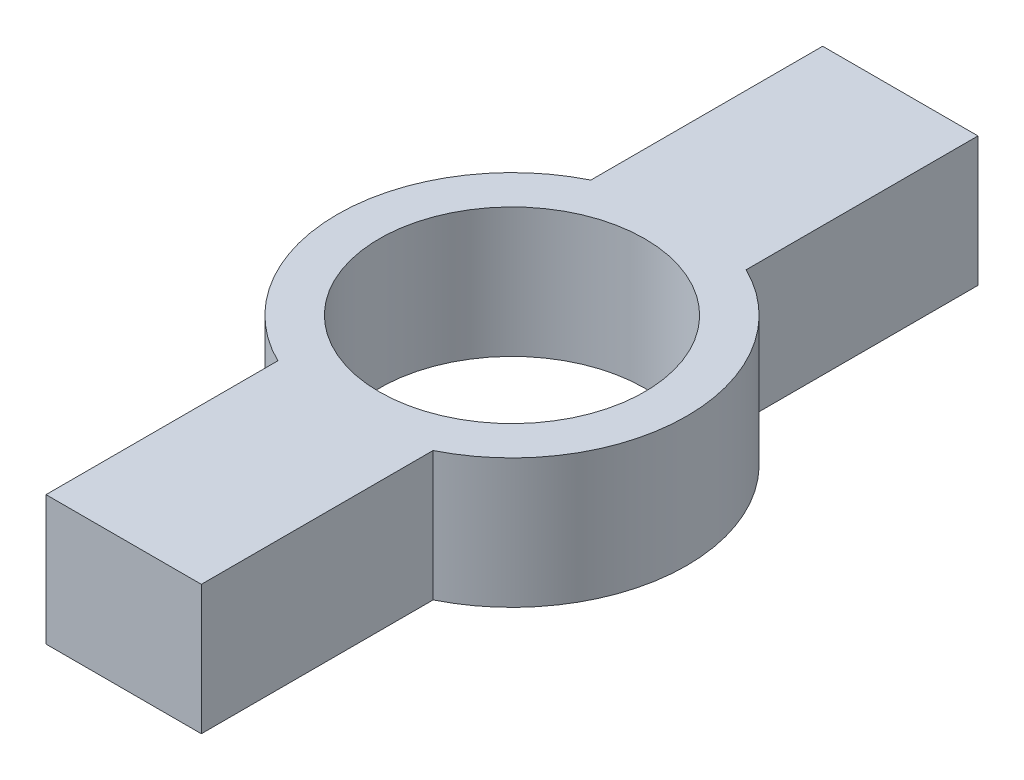
from build123d import *

# Parameters (mm, degrees)
SKETCH_1_R          = 13.5
EXTRUDE_1_DEPTH     = 10
SKETCH_2_W          = 12
SKETCH_2_H          = 60
EXTRUDE_2_DEPTH     = 10
SKETCH_3_R          = 10.25
CUT_EXTRUDE_1_DEPTH = 10


with BuildPart() as part:
    # 草图1 → 凸台-拉伸1 (new body)
    with BuildSketch(Plane(origin=(0, 0, 0), x_dir=(1, 0, 0), z_dir=(0, 1, 0))):
        with Locations(Location((0, 0, 0), (0, 0, 270))):
            Circle(SKETCH_1_R)
    extrude(amount=EXTRUDE_1_DEPTH)

    # 草图2 → 凸台-拉伸2 (add)
    with BuildSketch(Plane(origin=(0, 10, 0), x_dir=(1, 0, 0), z_dir=(0, 1, 0))):
        Rectangle(SKETCH_2_W, SKETCH_2_H)
    extrude(amount=-EXTRUDE_2_DEPTH)

    # 草图3 → 切除-拉伸1 (cut)
    with BuildSketch(Plane(origin=(0, 10, 0), x_dir=(1, 0, 0), z_dir=(0, 1, 0))):
        with Locations(Location((0, 0, 0), (0, 0, 270))):
            Circle(SKETCH_3_R)
    extrude(amount=-CUT_EXTRUDE_1_DEPTH, mode=Mode.SUBTRACT)


solid = part.part
